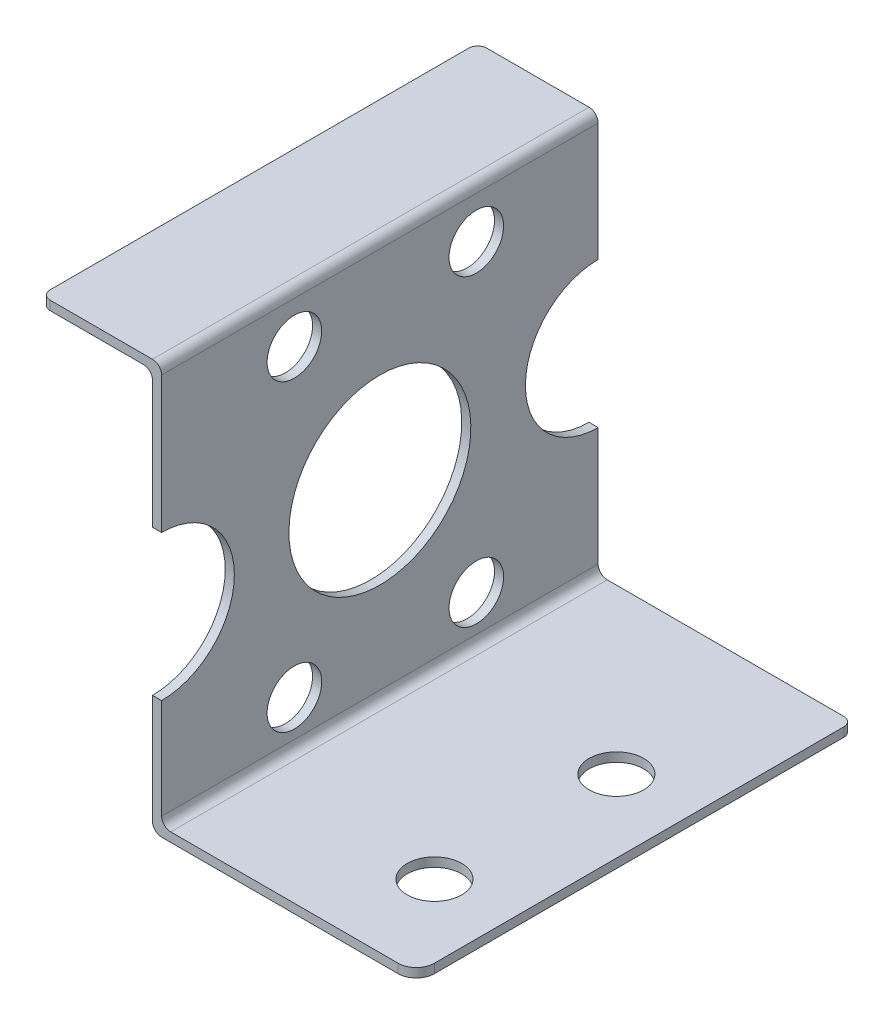
from build123d import *

# Parameters (mm, degrees)
EXTRUDE_THIN1_DEPTH = 24
SKETCH2_R           = 1.5
CUT_EXTRUDE1_DEPTH  = 10
SKETCH3_R           = 1.5
CUT_EXTRUDE2_DEPTH  = 10
FILLET1_R           = 1
FILLET2_R           = 0.5
FILLET3_R           = 0.5
SKETCH4_R           = 5
CUT_EXTRUDE3_DEPTH  = 10
CUT_EXTRUDE5_DEPTH  = 10


with BuildPart() as part:
    # Sketch1 → Extrude-Thin1 (new body)
    with BuildSketch(Plane.XY):
        Polygon((-6.621018809, 22), (0, 22), (0, 0), (14, 0), (14, -0.5), (-0.5, -0.5), (-0.5, 21.5), (-6.621018809, 21.5), align=None)
    extrude(amount=EXTRUDE_THIN1_DEPTH)

    # Sketch2 → Cut-Extrude1 (cut)
    with BuildSketch(Plane(origin=(0, 0, 0), x_dir=(1, 0, 0), z_dir=(0, 1, 0))):
        with Locations(Location((10, -19, 0), (0, 0, 270))):
            Circle(SKETCH2_R)
        with Locations(Location((10, -9, 0), (0, 0, 270))):
            Circle(SKETCH2_R)
    extrude(amount=-CUT_EXTRUDE1_DEPTH, mode=Mode.SUBTRACT)

    # Sketch3 → Cut-Extrude2 (cut)
    with BuildSketch(Plane(origin=(0, 0, 0), x_dir=(0, 0, -1), z_dir=(1, 0, 0))):
        with Locations((-16.7, 19.2)):
            Circle(SKETCH3_R)
        with Locations((-16.7, 2.5)):
            Circle(SKETCH3_R)
        with Locations((-6.7, 19.2)):
            Circle(SKETCH3_R)
        with Locations((-6.7, 2.5)):
            Circle(SKETCH3_R)
    extrude(amount=-CUT_EXTRUDE2_DEPTH, mode=Mode.SUBTRACT)

    # Fillet1
    fillet1_edges = [part.edges().sort_by_distance(p)[0] for p in [
        (14, -0.25, 24),
    ]]
    fillet(fillet1_edges, radius=FILLET1_R)

    # Fillet2
    fillet2_edges = [part.edges().sort_by_distance(p)[0] for p in [
        (-0.5, -0.5, 12),
        (-0.5, 21.5, 12),
        (0, 0, 12),
        (-6.621018809, 21.75, 24),
        (-6.621018809, 21.75, 0),
        (14, -0.25, 0),
    ]]
    fillet(fillet2_edges, radius=FILLET2_R)

    # Fillet3
    fillet3_edges = [part.edges().sort_by_distance(p)[0] for p in [
        (0, 22, 12),
    ]]
    fillet(fillet3_edges, radius=FILLET3_R)

    # Sketch4 → Cut-Extrude3 (cut)
    with BuildSketch(Plane(origin=(0, 0, 0), x_dir=(0, 0, -1), z_dir=(1, 0, 0))):
        with Locations(Location((-12, 10.5, 0), (0, 0, 90))):
            Circle(SKETCH4_R)
    extrude(amount=-CUT_EXTRUDE3_DEPTH, mode=Mode.SUBTRACT)

    # Sketch5 → Cut-Extrude5 (cut)
    with BuildSketch(Plane(origin=(0, 0, 0), x_dir=(0, 0, -1), z_dir=(1, 0, 0))):
        with BuildLine():
            Line((0, 15), (0, 7))
            ThreePointArc((0, 7), (-4, 11), (0, 15))
        make_face()
        with BuildLine():
            Line((-24, 14), (-24, 6))
            ThreePointArc((-24, 6), (-20, 10), (-24, 14))
        make_face()
    extrude(amount=-CUT_EXTRUDE5_DEPTH, mode=Mode.SUBTRACT)


solid = part.part
